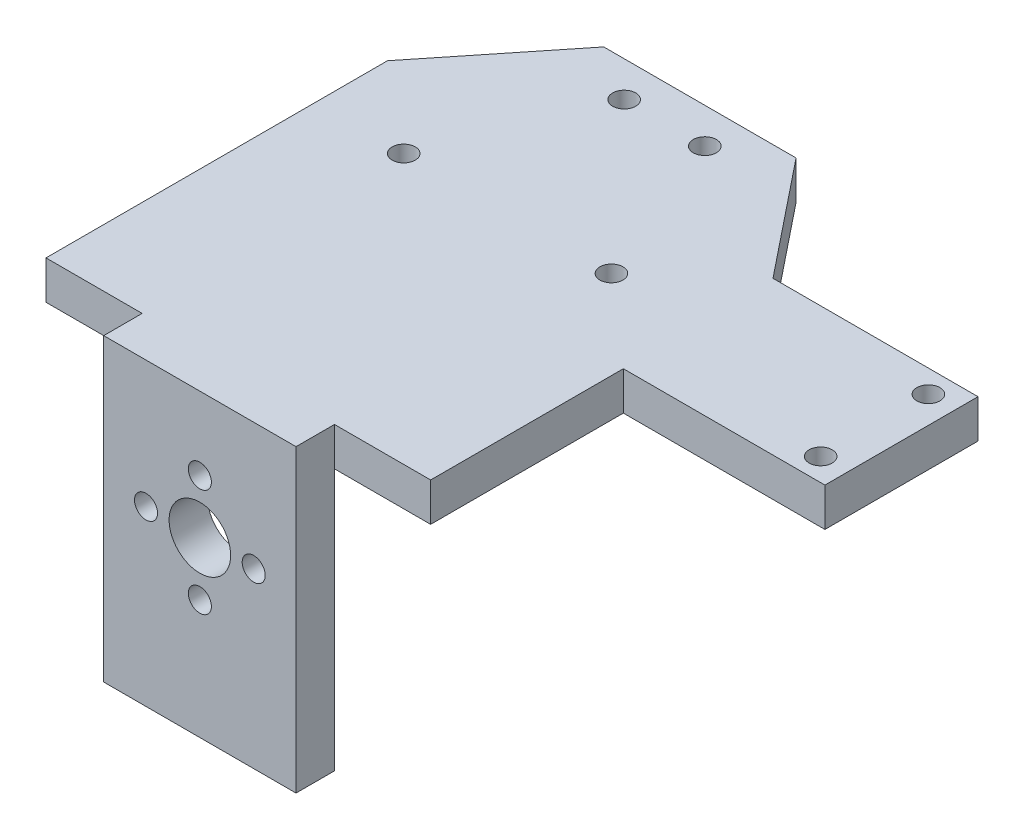
from build123d import *

# Parameters (mm, degrees)
SKETCH_1_R      = 1.5
EXTRUDE_1_DEPTH = 5
SKETCH_2_W      = 25
SKETCH_2_H      = 34
SKETCH_2_R      = 1.5
SKETCH_2_R_2    = 4
SKETCH_2_H_2    = 5
EXTRUDE_2_DEPTH = 5
SKETCH_3_R      = 1.5
EXTRUDE_3_DEPTH = 5


with BuildPart() as part:
    # 스케치1 → 보스-돌출1 (new body)
    with BuildSketch(Plane(origin=(0, 0, 0), x_dir=(1, 0, 0), z_dir=(0, 1, 0))):
        Polygon((12.5, 30), (-12.5, 30), (-25, 14.387505004), (-25, -30), (25, -30), (25, 14.387505004), align=None)
        with Locations(Location((-13.5, 5, 0), (0, 0, 270))):
            Circle(SKETCH_1_R, mode=Mode.SUBTRACT)
        with Locations(Location((-5.24, 25.4, 0), (0, 0, 270))):
            Circle(SKETCH_1_R, mode=Mode.SUBTRACT)
        with Locations(Location((13.5, 5, 0), (0, 0, 270))):
            Circle(SKETCH_1_R, mode=Mode.SUBTRACT)
        with Locations(Location((5.24, 25.4, 0), (0, 0, 270))):
            Circle(SKETCH_1_R, mode=Mode.SUBTRACT)
    extrude(amount=EXTRUDE_1_DEPTH)

    # 스케치2 → 보스-돌출2 (add)
    # profile 1 of 2: a face of its own
    with BuildSketch(Plane.XY.offset(30)):
        with Locations((0, -17)):
            Rectangle(SKETCH_2_W, SKETCH_2_H)
        with Locations((0, -18.5)):
            Circle(SKETCH_2_R, mode=Mode.SUBTRACT)
        with Locations((-7, -11.5)):
            Circle(SKETCH_2_R, mode=Mode.SUBTRACT)
        with Locations((0, -11.5)):
            Circle(SKETCH_2_R_2, mode=Mode.SUBTRACT)
        with Locations((7, -11.5)):
            Circle(SKETCH_2_R, mode=Mode.SUBTRACT)
        with Locations((0, -4.5)):
            Circle(SKETCH_2_R, mode=Mode.SUBTRACT)
    # profile 2 of 2: a face of its own
    with BuildSketch(Plane.XY.offset(30)):
        with Locations((0, 2.5)):
            Rectangle(SKETCH_2_W, SKETCH_2_H_2)
    extrude(amount=EXTRUDE_2_DEPTH)

    # 스케치3 → 보스-돌출3 (add)
    with BuildSketch(Plane(origin=(0, 5, 0), x_dir=(1, 0, 0), z_dir=(0, 1, 0))):
        Polygon((51.2, 14.95), (51.2, -4.95), (25, -4.95), (25, 14.387505004), (24.549643574, 14.95), align=None)
        with Locations(Location((47.7, -2, 0), (0, 0, 270))):
            Circle(SKETCH_3_R, mode=Mode.SUBTRACT)
        with Locations(Location((47.7, 12, 0), (0, 0, 90))):
            Circle(SKETCH_3_R, mode=Mode.SUBTRACT)
    extrude(amount=-EXTRUDE_3_DEPTH)


solid = part.part
